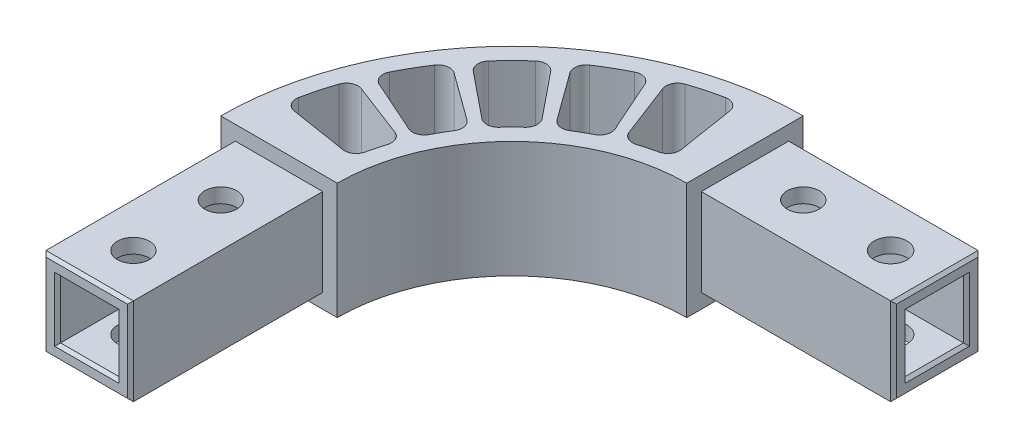
from build123d import *

# Parameters (mm, degrees)
BOSS_EXTRUDE1_DEPTH = 20
SKETCH2_W           = 15
SKETCH2_H           = 15
BOSS_EXTRUDE2_DEPTH = 33
SKETCH3_W           = 15
SKETCH3_H           = 15
BOSS_EXTRUDE3_DEPTH = 33
SKETCH4_R           = 2.75
SKETCH4_R_2         = 2.825
CUT_EXTRUDE1_DEPTH  = 73.844011422
CUT_EXTRUDE2_DEPTH  = 74.484692283
SKETCH6_W           = 10
SKETCH6_H           = 10
CUT_EXTRUDE3_DEPTH  = 33
SKETCH7_W           = 10
SKETCH7_H           = 10
CUT_EXTRUDE4_DEPTH  = 33
CHAMFER1_SIZE       = 0.5


with BuildPart() as part:
    # Sketch1 → Boss-Extrude1 (new body)
    with BuildSketch(Plane(origin=(0, 0, 0), x_dir=(1, 0, 0), z_dir=(0, 1, 0))):
        with BuildLine():
            Line((0, 50), (0, 30))
            ThreePointArc((0, 30), (-21.213203436, 21.213203436), (-30, 0))
            Line((-30, 0), (-50, 0))
            ThreePointArc((-50, 0), (-35.355339059, 35.355339059), (0, 50))
        make_face()
    extrude(amount=BOSS_EXTRUDE1_DEPTH)

    # Sketch2 → Boss-Extrude2 (add)
    with BuildSketch(Plane.XY):
        with Locations((-40, 10)):
            Rectangle(SKETCH2_W, SKETCH2_H)
    extrude(amount=BOSS_EXTRUDE2_DEPTH)

    # Sketch3 → Boss-Extrude3 (add)
    with BuildSketch(Plane(origin=(0, 0, 0), x_dir=(0, 0, -1), z_dir=(1, 0, 0))):
        with Locations((40, 10)):
            Rectangle(SKETCH3_W, SKETCH3_H)
    extrude(amount=BOSS_EXTRUDE3_DEPTH)

    # Sketch4 → Cut-Extrude1 (cut, through all)
    with BuildSketch(Plane(origin=(0, 17.5, 0), x_dir=(1, 0, 0), z_dir=(0, 1, 0))):
        with Locations(Location((10, 40, 0), (0, 0, 270))):
            Circle(SKETCH4_R)
        with Locations(Location((25, 40, 0), (0, 0, 270))):
            Circle(SKETCH4_R_2)
        with Locations(Location((-40, -10, 0), (0, 0, 270))):
            Circle(SKETCH4_R)
        with Locations(Location((-40, -25, 0), (0, 0, 270))):
            Circle(SKETCH4_R)
    extrude(amount=-CUT_EXTRUDE1_DEPTH, mode=Mode.SUBTRACT)

    # Sketch5 → Cut-Extrude2 (cut, through all)
    with BuildSketch(Plane(origin=(0, 20, 0), x_dir=(1, 0, 0), z_dir=(0, 1, 0))):
        with BuildLine():
            Line((-21.990223117, 27.155663999), (-28.291433976, 34.937011371))
            ThreePointArc((-28.291433976, 34.937011371), (-29.68093252, 35.671569812), (-31.172202606, 35.17518706))
            ThreePointArc((-31.172202606, 35.17518706), (-33.234018716, 33.234018716), (-35.17518706, 31.172202606))
            ThreePointArc((-35.17518706, 31.172202606), (-35.671569812, 29.68093252), (-34.937011371, 28.291433976))
            Line((-34.937011371, 28.291433976), (-27.155663999, 21.990223117))
            ThreePointArc((-27.155663999, 21.990223117), (-25.744904759, 21.550308438), (-24.417193319, 22.199114181))
            ThreePointArc((-24.417193319, 22.199114181), (-23.334523779, 23.334523779), (-22.199114181, 24.417193319))
            ThreePointArc((-22.199114181, 24.417193319), (-21.550308438, 25.744904759), (-21.990223117, 27.155663999))
        make_face()
        with BuildLine():
            Line((-20.538868638, 28.26932746), (-26.424199651, 36.369790662))
            ThreePointArc((-26.424199651, 36.369790662), (-26.774099933, 37.902060905), (-25.908661914, 39.214043885))
            ThreePointArc((-25.908661914, 39.214043885), (-23.5, 40.703193978), (-21.006027233, 42.044581338))
            ThreePointArc((-21.006027233, 42.044581338), (-19.437097633, 42.138081158), (-18.285062818, 41.068923503))
            Line((-18.285062818, 41.068923503), (-14.21252141, 31.921845736))
            ThreePointArc((-14.21252141, 31.921845736), (-14.152727818, 30.445298653), (-15.123063049, 29.330751167))
            ThreePointArc((-15.123063049, 29.330751167), (-16.5, 28.578838325), (-17.839644098, 27.762332367))
            ThreePointArc((-17.839644098, 27.762332367), (-19.290038151, 27.47927115), (-20.538868638, 28.26932746))
        make_face()
        with BuildLine():
            Line((-12.522383321, 32.621923854), (-16.110622392, 41.969606219))
            ThreePointArc((-16.110622392, 41.969606219), (-16.05201939, 43.540226476), (-14.876504274, 44.583512878))
            ThreePointArc((-14.876504274, 44.583512878), (-12.16449512, 45.398513836), (-9.408325818, 46.04870688))
            ThreePointArc((-9.408325818, 46.04870688), (-7.868656664, 45.73295191), (-7.032594847, 44.402056368))
            Line((-7.032594847, 44.402056368), (-5.466259855, 34.512606439))
            ThreePointArc((-5.466259855, 34.512606439), (-5.790662187, 33.070895758), (-7.016400163, 32.245466794))
            ThreePointArc((-7.016400163, 32.245466794), (-8.541028488, 31.875552268), (-10.046352613, 31.433593482))
            ThreePointArc((-10.046352613, 31.433593482), (-11.52058732, 31.535566946), (-12.522383321, 32.621923854))
        make_face()
        with BuildLine():
            Line((-31.921845736, 14.21252141), (-41.068923503, 18.285062818))
            ThreePointArc((-41.068923503, 18.285062818), (-42.138081158, 19.437097633), (-42.044581338, 21.006027233))
            ThreePointArc((-42.044581338, 21.006027233), (-40.703193978, 23.5), (-39.214043885, 25.908661914))
            ThreePointArc((-39.214043885, 25.908661914), (-37.902060905, 26.774099933), (-36.369790662, 26.424199651))
            Line((-36.369790662, 26.424199651), (-28.26932746, 20.538868638))
            ThreePointArc((-28.26932746, 20.538868638), (-27.47927115, 19.290038151), (-27.762332367, 17.839644098))
            ThreePointArc((-27.762332367, 17.839644098), (-28.578838325, 16.5), (-29.330751167, 15.123063049))
            ThreePointArc((-29.330751167, 15.123063049), (-30.445298653, 14.152727818), (-31.921845736, 14.21252141))
        make_face()
        with BuildLine():
            Line((-34.512606439, 5.466259855), (-44.402056368, 7.032594847))
            ThreePointArc((-44.402056368, 7.032594847), (-45.73295191, 7.868656664), (-46.04870688, 9.408325818))
            ThreePointArc((-46.04870688, 9.408325818), (-45.398513836, 12.16449512), (-44.583512878, 14.876504274))
            ThreePointArc((-44.583512878, 14.876504274), (-43.540226476, 16.05201939), (-41.969606219, 16.110622392))
            Line((-41.969606219, 16.110622392), (-32.621923854, 12.522383321))
            ThreePointArc((-32.621923854, 12.522383321), (-31.535566946, 11.52058732), (-31.433593482, 10.046352613))
            ThreePointArc((-31.433593482, 10.046352613), (-31.875552268, 8.541028488), (-32.245466794, 7.016400163))
            ThreePointArc((-32.245466794, 7.016400163), (-33.070895758, 5.790662187), (-34.512606439, 5.466259855))
        make_face()
    extrude(amount=-CUT_EXTRUDE2_DEPTH, mode=Mode.SUBTRACT)

    # Sketch6 → Cut-Extrude3 (cut)
    with BuildSketch(Plane(origin=(33, 0, 0), x_dir=(0, 0, -1), z_dir=(1, 0, 0))):
        with Locations((40, 10)):
            Rectangle(SKETCH6_W, SKETCH6_H)
    extrude(amount=-CUT_EXTRUDE3_DEPTH, mode=Mode.SUBTRACT)

    # Sketch7 → Cut-Extrude4 (cut)
    with BuildSketch(Plane.XY.offset(33)):
        with Locations((-40, 10)):
            Rectangle(SKETCH7_W, SKETCH7_H)
    extrude(amount=-CUT_EXTRUDE4_DEPTH, mode=Mode.SUBTRACT)

    # Chamfer1
    chamfer1_edges = [part.edges().sort_by_distance(p)[0] for p in [
        (-32.5, 10, 33),
        (-40, 17.5, 33),
        (-47.5, 10, 33),
        (-40, 2.5, 33),
        (33, 10, -45),
        (33, 15, -40),
        (33, 10, -35),
        (33, 5, -40),
        (-35, 10, 33),
        (-40, 15, 33),
        (-45, 10, 33),
        (-40, 5, 33),
        (33, 10, -47.5),
        (33, 17.5, -40),
        (33, 10, -32.5),
        (33, 2.5, -40),
    ]]
    chamfer(chamfer1_edges, length=CHAMFER1_SIZE)


solid = part.part
